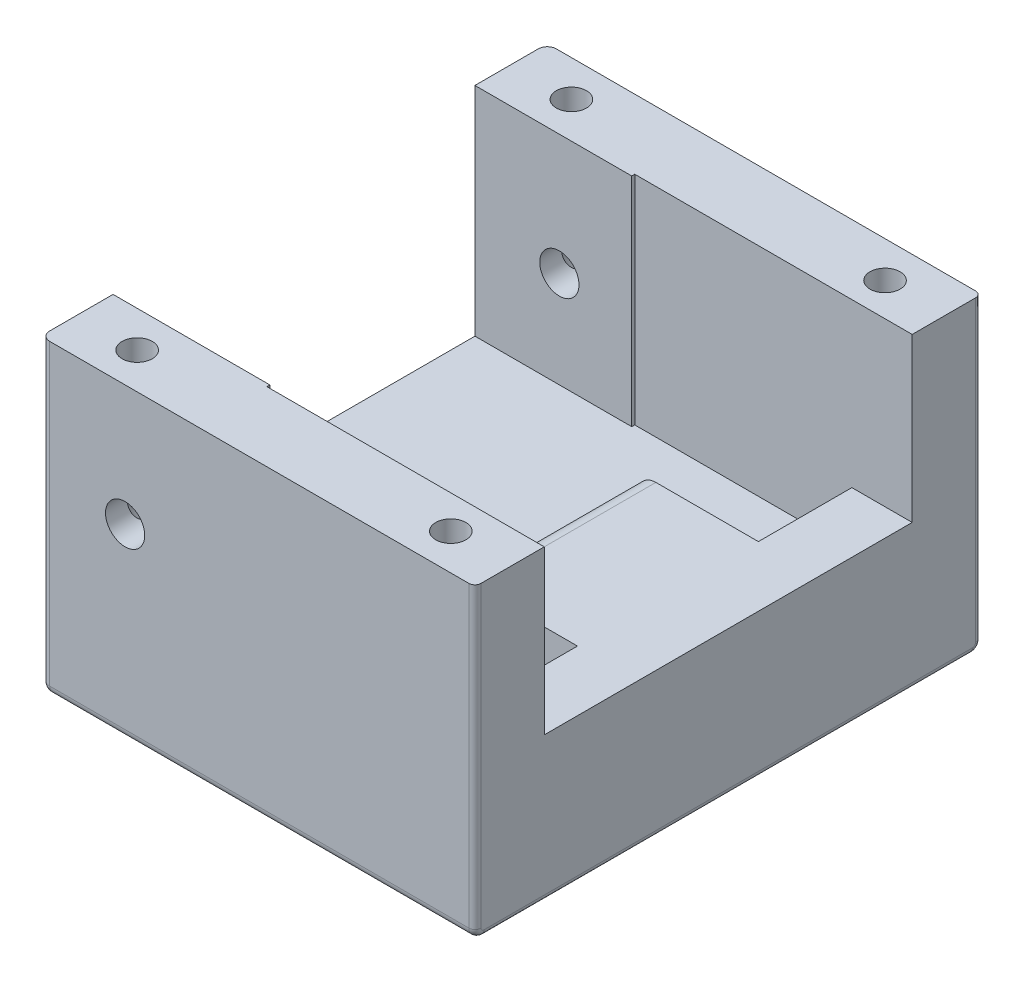
from build123d import *

# Parameters (mm, degrees)
SKETCH1_W               = 36
SKETCH1_H               = 30
BASE_PLATE_DEPTH        = 7.5
SKETCH2_W               = 36
SKETCH2_H               = 6
SIDE_WALLS_DEPTH        = 25.5
SKETCH4_R               = 1.25
M2_SCREWS_DEPTH         = 25.5
SKETCH6_W               = 5
SKETCH6_H               = 30
RETURN_STOPPER_DEPTH    = 4.5
SKETCH9_W               = 10
SKETCH9_H               = 15
BOSS_EXTRUDE1_DEPTH     = 4.5
SKETCH7_R               = 6.25
MAGNET_POCKET_DEPTH     = 11
SKETCH8_R               = 2
M2_SCREW_HEAD_DEPTH     = 1.5
M3_ACHSE_DEPTH          = 48.647140523
M3_ACHSE_DEPTH_BACK     = 48.647140523
SKETCH5_R               = 1.625
FILLET1_R               = 1.5
LEAVER_SPACE_DEPTH      = 30.25
LEAVER_SPACE_DEPTH_BACK = 0.25
SKETCH11_W              = 23
SKETCH11_H              = 13.5
SKETCH12_W              = 18
SKETCH12_H              = 4.5
MORE_SPACE_LEFT_DEPTH   = 0.25
SKETCH13_W              = 18
SKETCH13_H              = 4.5
MORE_SPACE_RIGHT_DEPTH  = 0.25
FILLET2_R               = 0.75
FILLET3_R               = 0.75
FILLET4_R               = 0.75
FILLET5_R               = 0.5


with BuildPart() as part:
    # Sketch1 → Base Plate (new body)
    with BuildSketch(Plane(origin=(0, 0, 0), x_dir=(1, 0, 0), z_dir=(0, 1, 0))):
        Rectangle(SKETCH1_W, SKETCH1_H)
    extrude(amount=BASE_PLATE_DEPTH)

    # Sketch2 → Side Walls (add)
    with BuildSketch(Plane.XZ):
        with Locations((0, -18)):
            Rectangle(SKETCH2_W, SKETCH2_H)
        with Locations((0, 18)):
            Rectangle(SKETCH2_W, SKETCH2_H)
    extrude(amount=-SIDE_WALLS_DEPTH)

    # Sketch4 → M2 Screws (cut)
    with BuildSketch(Plane(origin=(0, 25.5, 0), x_dir=(1, 0, 0), z_dir=(0, 1, 0))):
        with Locations(Location((-13, -18, 0), (0, 0, 270))):
            Circle(SKETCH4_R)
        with Locations(Location((13, -18, 0), (0, 0, 270))):
            Circle(SKETCH4_R)
        with Locations(Location((13, 18, 0), (0, 0, 270))):
            Circle(SKETCH4_R)
        with Locations(Location((-13, 18, 0), (0, 0, 270))):
            Circle(SKETCH4_R)
    extrude(amount=-M2_SCREWS_DEPTH, mode=Mode.SUBTRACT)

    # Sketch6 → Return Stopper (add)
    with BuildSketch(Plane(origin=(0, 7.5, 0), x_dir=(1, 0, 0), z_dir=(0, 1, 0))):
        with Locations((15.5, 0)):
            Rectangle(SKETCH6_W, SKETCH6_H)
    extrude(amount=RETURN_STOPPER_DEPTH)

    # Sketch9 → Boss-Extrude1 (add)
    with BuildSketch(Plane(origin=(0, 7.5, 0), x_dir=(1, 0, 0), z_dir=(0, 1, 0))):
        with Locations((8, 0)):
            Rectangle(SKETCH9_W, SKETCH9_H)
    extrude(amount=BOSS_EXTRUDE1_DEPTH)

    # Sketch7 → Magnet Pocket (cut)
    with BuildSketch(Plane(origin=(0, 0, 0), x_dir=(-1, 0, 0), z_dir=(0, 1, 0))):
        with Locations(Location((-11, 0, 0), (0, 0, 270))):
            Circle(SKETCH7_R)
    extrude(amount=MAGNET_POCKET_DEPTH, mode=Mode.SUBTRACT)

    # Sketch8 → M2 Screw Head (cut)
    with BuildSketch(Plane.XZ):
        with Locations(Location((13, -18, 0), (0, 0, 270))):
            Circle(SKETCH8_R)
        with Locations(Location((-13, -18, 0), (0, 0, 270))):
            Circle(SKETCH8_R)
        with Locations(Location((13, 18, 0), (0, 0, 270))):
            Circle(SKETCH8_R)
        with Locations(Location((-13, 18, 0), (0, 0, 270))):
            Circle(SKETCH8_R)
    extrude(amount=-M2_SCREW_HEAD_DEPTH, mode=Mode.SUBTRACT)

    # Sketch5 → M3 Achse (cut, two sides: drawn at the far end of the back side and taken through both)
    with BuildSketch(Plane.XY.offset(-15).offset(-M3_ACHSE_DEPTH_BACK)):
        with Locations((-11, 15.5)):
            Circle(SKETCH5_R)
    extrude(amount=M3_ACHSE_DEPTH + M3_ACHSE_DEPTH_BACK, mode=Mode.SUBTRACT)

    # Fillet1
    fillet1_edges = [part.edges().sort_by_distance(p)[0] for p in [
        (3, 12, 0),
    ]]
    fillet(fillet1_edges, radius=FILLET1_R)

    # Sketch11 → Leaver Space (cut, two sides: drawn at the far end of the back side and taken through both)
    with BuildSketch(Plane.XY.offset(-15).offset(-LEAVER_SPACE_DEPTH_BACK)):
        with Locations((6.5, 18.75)):
            Rectangle(SKETCH11_W, SKETCH11_H)
    extrude(amount=LEAVER_SPACE_DEPTH + LEAVER_SPACE_DEPTH_BACK, mode=Mode.SUBTRACT)

    # Sketch12 → More Space left (cut)
    with BuildSketch(Plane.XY.offset(-15)):
        with Locations((4, 9.75)):
            Rectangle(SKETCH12_W, SKETCH12_H)
    extrude(amount=-MORE_SPACE_LEFT_DEPTH, mode=Mode.SUBTRACT)

    # Sketch13 → More Space right (cut)
    with BuildSketch(Plane(origin=(0, 0, 15), x_dir=(-1, 0, 0), z_dir=(0, 0, -1))):
        with Locations((-4, 9.75)):
            Rectangle(SKETCH13_W, SKETCH13_H)
    extrude(amount=-MORE_SPACE_RIGHT_DEPTH, mode=Mode.SUBTRACT)

    # Fillet2
    fillet2_edges = [part.edges().sort_by_distance(p)[0] for p in [
        (0, 0, -21),
    ]]
    fillet(fillet2_edges, radius=FILLET2_R)

    # Fillet3
    fillet3_edges = [part.edges().sort_by_distance(p)[0] for p in [
        (0, 0, 21),
    ]]
    fillet(fillet3_edges, radius=FILLET3_R)

    # Fillet4
    fillet4_edges = [part.edges().sort_by_distance(p)[0] for p in [
        (-18, 13.125, 21),
        (-18, 0, 0),
        (-18, 0.219669914, -20.780330086),
        (-18, 0.219669914, 20.780330086),
        (-18, 13.125, -21),
    ]]
    fillet(fillet4_edges, radius=FILLET4_R)

    # Fillet5
    fillet5_edges = [part.edges().sort_by_distance(p)[0] for p in [
        (18, 13.125, 21),
        (18, 0.219669914, -20.780330086),
        (18, 0, 0),
        (18, 0.219669914, 20.780330086),
        (18, 13.125, -21),
    ]]
    fillet(fillet5_edges, radius=FILLET5_R)


solid = part.part
